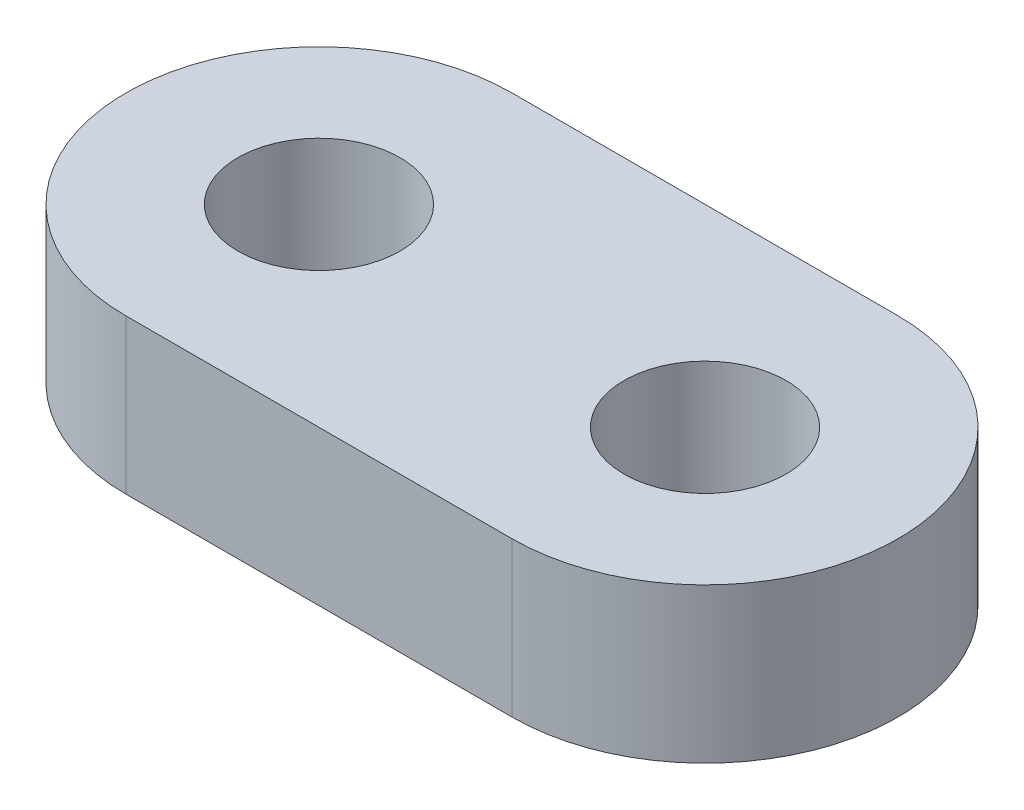
from build123d import *

# Parameters (mm, degrees)
SKETCH1_R           = 1.05
BOSS_EXTRUDE1_DEPTH = 2


with BuildPart() as part:
    # Sketch1 → Boss-Extrude1 (new body)
    with BuildSketch(Plane(origin=(0, 0, 0), x_dir=(1, 0, 0), z_dir=(0, 1, 0))):
        with BuildLine():
            Line((0, 2.5), (5, 2.5))
            ThreePointArc((5, 2.5), (7.5, 0), (5, -2.5))
            Line((5, -2.5), (0, -2.5))
            ThreePointArc((0, -2.5), (-2.5, 0), (0, 2.5))
        make_face()
        with Locations(Location((0, 0, 0), (0, 0, 270))):
            Circle(SKETCH1_R, mode=Mode.SUBTRACT)
        with Locations(Location((5, 0, 0), (0, 0, 270))):
            Circle(SKETCH1_R, mode=Mode.SUBTRACT)
    extrude(amount=BOSS_EXTRUDE1_DEPTH)


solid = part.part
